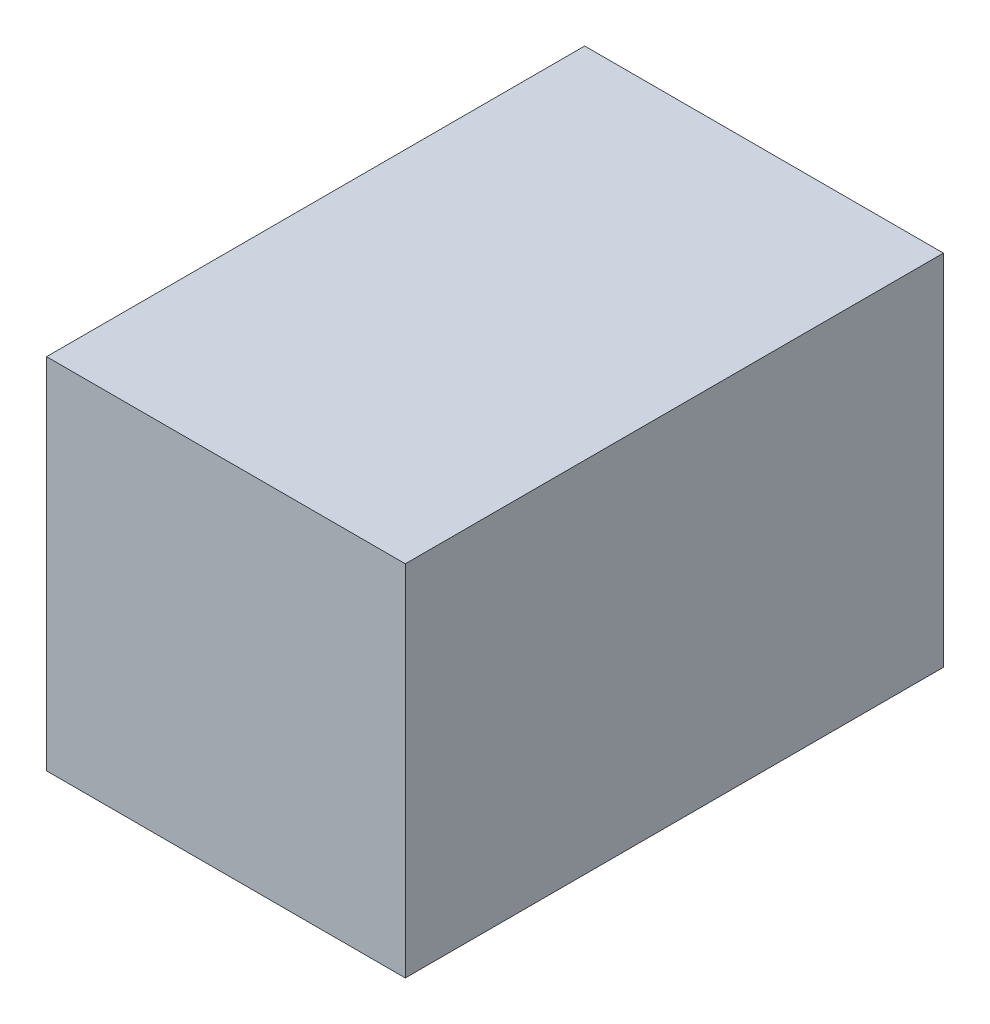
from build123d import *

# Parameters (mm, degrees)
SKETCH1_W           = 101.6
SKETCH1_H           = 101.6
BOSS_EXTRUDE1_DEPTH = 152.4


with BuildPart() as part:
    # Sketch1 → Boss-Extrude1 (new body)
    with BuildSketch(Plane.XY):
        Rectangle(SKETCH1_W, SKETCH1_H)
    extrude(amount=BOSS_EXTRUDE1_DEPTH)


solid = part.part
